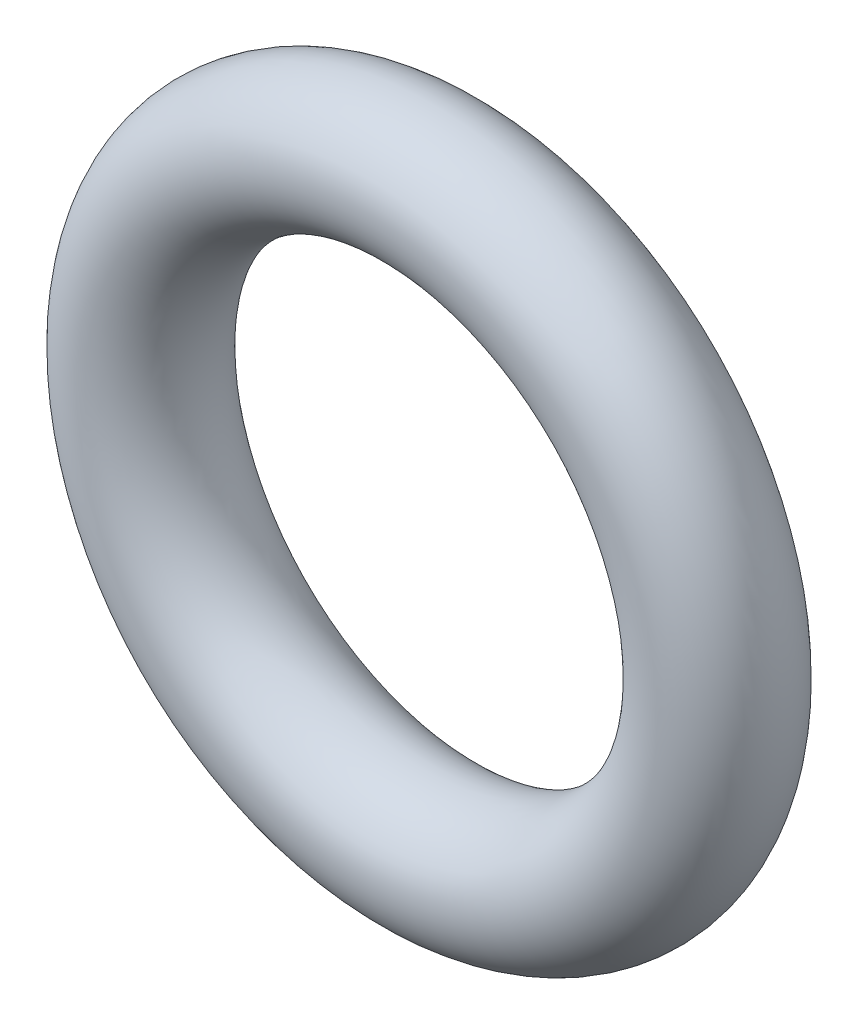
from build123d import *

# Parameters (mm, degrees)
SWEEP1_PROFILE_R = 0.75


with BuildPart() as part:
    # Sweep1: sweep along a path in Sketch1
    with BuildLine(Plane.XY) as sweep1_path:
        CenterArc((0, 0), 3.25, 0, 360)
    # Sweep1 profile (on start of the path) → Sweep1 (sweep)
    with BuildSketch(Plane(origin=(3.25, 0, 0), x_dir=(0, 0, 1), z_dir=(0, 1, 0))):
        Circle(SWEEP1_PROFILE_R)
    sweep(path=sweep1_path.line)


solid = part.part
